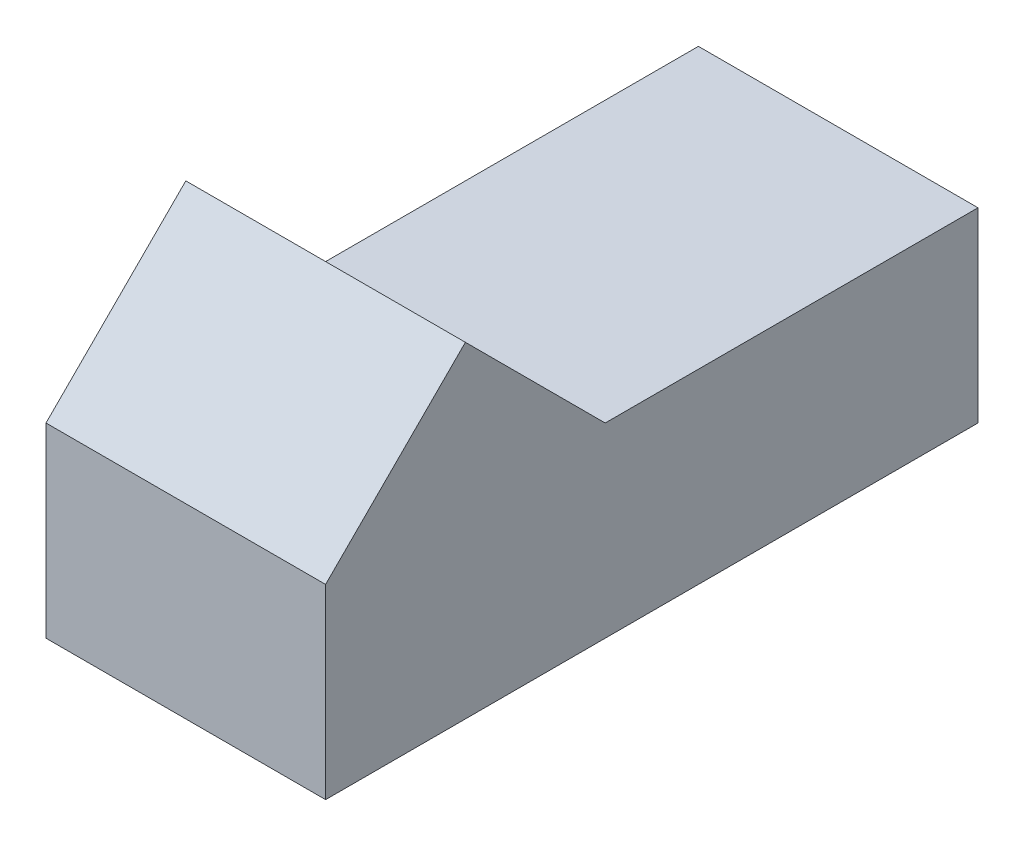
from build123d import *

# Parameters (mm, degrees)
BOSS_EXTRUDE1_DEPTH = 3


with BuildPart() as part:
    # Sketch2 → Boss-Extrude1 (new body)
    with BuildSketch(Plane(origin=(0, 0, 0), x_dir=(0, 0, -1), z_dir=(1, 0, 0))):
        Polygon((0.000317111, 27.796332929), (0.000317111, 29.796332929), (-3.999682889, 29.796332929), (-5.499682889, 31.296332929), (-6.999682889, 29.796332929), (-6.999682889, 27.796332929), align=None)
    extrude(amount=BOSS_EXTRUDE1_DEPTH)


solid = part.part
